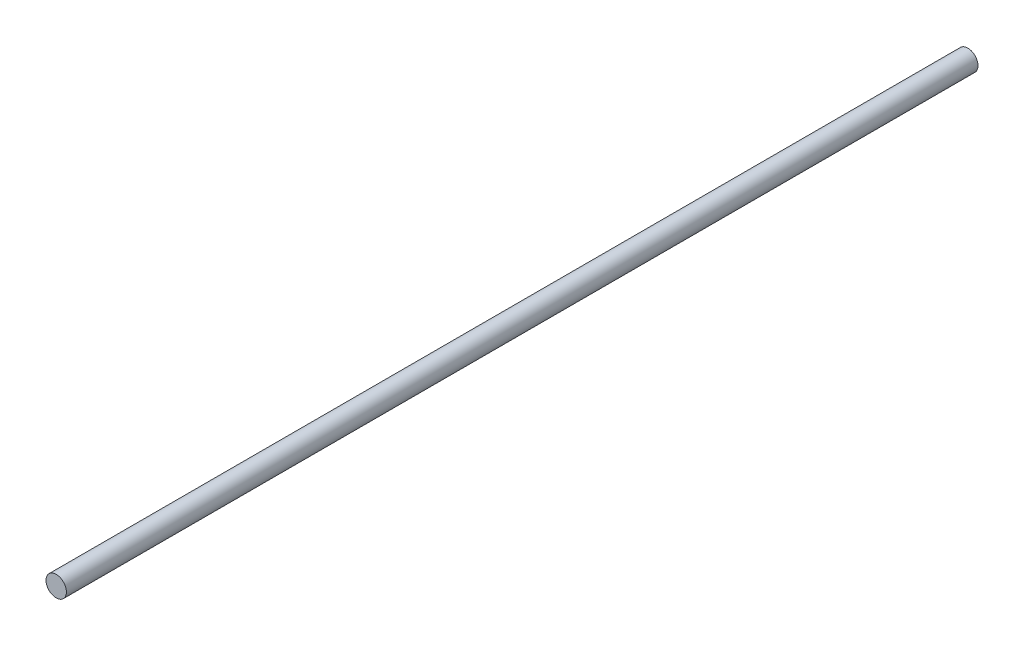
from build123d import *

# Parameters (mm, degrees)
SKETCH_1_R      = 1.5
EXTRUDE_1_DEPTH = 134


with BuildPart() as part:
    # 草图1 → 凸台-拉伸1 (new body)
    with BuildSketch(Plane.XY):
        Circle(SKETCH_1_R)
    extrude(amount=EXTRUDE_1_DEPTH)


solid = part.part
